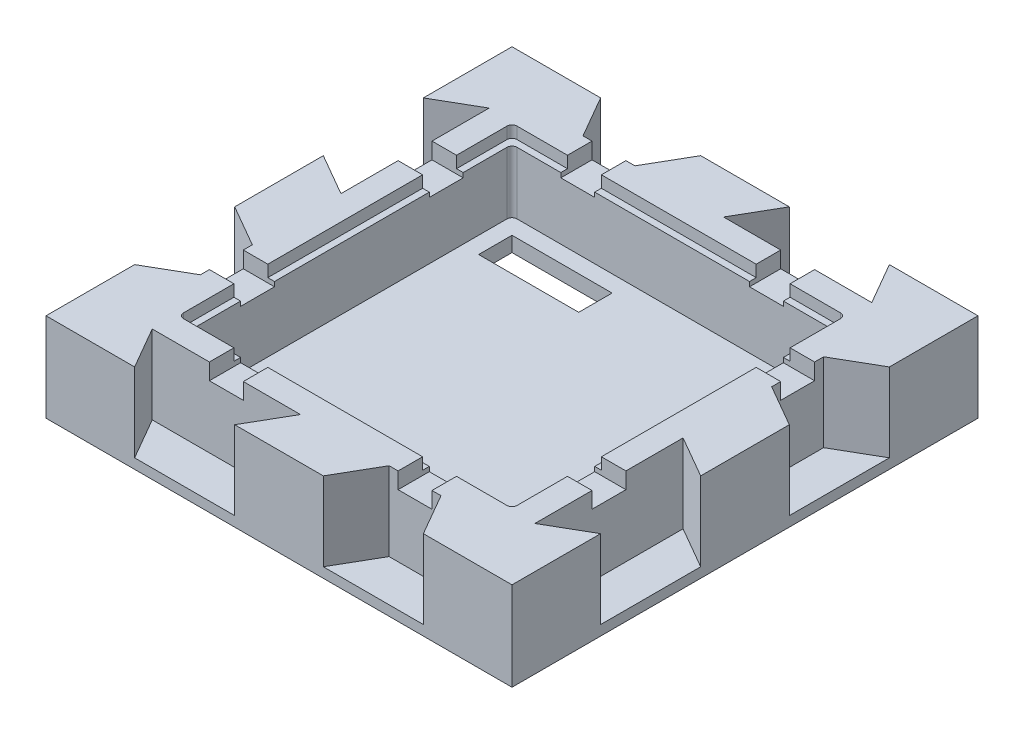
from build123d import *

# Parameters (mm, degrees)
SKETCH1_W           = 139.7
SKETCH1_H           = 139.7
BOSS_EXTRUDE1_DEPTH = 13.45
SKETCH2_W           = 139.7
SKETCH2_H           = 139.7
CUT_EXTRUDE1_DEPTH  = 0.3
CUT_EXTRUDE2_START  = -23.6
CUT_EXTRUDE2_DEPTH  = 126.901539578
SKETCH18_W          = 10.16
SKETCH18_H          = 4.875
CUT_EXTRUDE6_DEPTH  = 20
CIRPATTERN1_COUNT   = 4
SKETCH19_W          = 100
SKETCH19_H          = 100
CUT_EXTRUDE8_DEPTH  = 3.5
SKETCH20_W          = 96
SKETCH20_H          = 96
CUT_EXTRUDE9_DEPTH  = 18.6
SKETCH21_W          = 30
SKETCH21_H          = 10
CUT_EXTRUDE10_DEPTH = 102.224774635
FILLET2_R           = 1.5
CIRPATTERN2_COUNT   = 2


with BuildPart() as part:
    # Sketch1 → Boss-Extrude1 (new, symmetric)
    with BuildSketch(Plane(origin=(0, 0, 0), x_dir=(1, 0, 0), z_dir=(0, 1, 0))):
        Rectangle(SKETCH1_W, SKETCH1_H)
    extrude(amount=BOSS_EXTRUDE1_DEPTH, both=True)

    # Sketch2 → Cut-Extrude1 (cut)
    with BuildSketch(Plane(origin=(0, 13.45, 0), x_dir=(1, 0, 0), z_dir=(0, 1, 0))):
        Rectangle(SKETCH2_W, SKETCH2_H)
    extrude(amount=-CUT_EXTRUDE1_DEPTH, mode=Mode.SUBTRACT)

    # Sketch4 → Cut-Extrude2 (cut)
    with BuildSketch(Plane(origin=(0, 13.15, 0), x_dir=(1, 0, 0), z_dir=(0, 1, 0)).offset(CUT_EXTRUDE2_START)):
        Polygon((-43.283333333, -69.85), (-50.500211698, -57.35), (-6.066454968, -57.35), (-13.283333333, -69.85), align=None)
        Polygon((43.283333333, -69.85), (36.066454968, -57.35), (20.500211698, -57.35), (13.283333333, -69.85), align=None)
    cut_extrude2 = extrude(amount=CUT_EXTRUDE2_DEPTH, mode=Mode.SUBTRACT)

    # Sketch18 → Cut-Extrude6 (cut)
    with BuildSketch(Plane.XY.offset(57.35)):
        with Locations((28.283333333, 10.7125)):
            Rectangle(SKETCH18_W, SKETCH18_H)
        with Locations((-28.283333333, 10.7125)):
            Rectangle(SKETCH18_W, SKETCH18_H)
    cut_extrude6 = extrude(amount=-CUT_EXTRUDE6_DEPTH, mode=Mode.SUBTRACT)

    # CirPattern1: Cut-Extrude2, Cut-Extrude6 ×4 about axis
    cirpattern1_axis = Axis((0, 0, 0), (0, 1, 0))
    add([cut_extrude2.rotate(cirpattern1_axis, i * 360 / CIRPATTERN1_COUNT) for i in range(1, CIRPATTERN1_COUNT)], mode=Mode.SUBTRACT)
    add([cut_extrude6.rotate(cirpattern1_axis, i * 360 / CIRPATTERN1_COUNT) for i in range(1, CIRPATTERN1_COUNT)], mode=Mode.SUBTRACT)

    # Sketch19 → Cut-Extrude8 (cut)
    with BuildSketch(Plane(origin=(0, 13.15, 0), x_dir=(1, 0, 0), z_dir=(0, 1, 0))):
        Rectangle(SKETCH19_W, SKETCH19_H)
    extrude(amount=-CUT_EXTRUDE8_DEPTH, mode=Mode.SUBTRACT)

    # Sketch20 → Cut-Extrude9 (cut)
    with BuildSketch(Plane(origin=(0, 9.65, 0), x_dir=(1, 0, 0), z_dir=(0, 1, 0))):
        Rectangle(SKETCH20_W, SKETCH20_H)
    extrude(amount=-CUT_EXTRUDE9_DEPTH, mode=Mode.SUBTRACT)

    # Sketch21 → Cut-Extrude10 (cut, through all)
    with BuildSketch(Plane(origin=(0, -8.95, 0), x_dir=(1, 0, 0), z_dir=(0, 1, 0))):
        with Locations((-28, 38)):
            Rectangle(SKETCH21_W, SKETCH21_H)
    cut_extrude10 = extrude(amount=-CUT_EXTRUDE10_DEPTH, mode=Mode.SUBTRACT)

    # Fillet2
    fillet2_edges = [part.edges().sort_by_distance(p)[0] for p in [
        (50, 11.4, 50),
        (-50, 11.4, -50),
        (50, 11.4, -50),
        (-50, 11.4, 50),
        (48, 0.35, -48),
        (48, 0.35, 48),
        (-48, 0.35, 48),
        (-48, 0.35, -48),
    ]]
    fillet(fillet2_edges, radius=FILLET2_R)

    # CirPattern2: Cut-Extrude10 ×2 about axis
    cirpattern2_axis = Axis((0, 0, 0), (0, 1, 0))
    for i in range(1, CIRPATTERN2_COUNT):
        add(cut_extrude10.rotate(cirpattern2_axis, i * 360 / CIRPATTERN2_COUNT), mode=Mode.SUBTRACT)


solid = part.part
